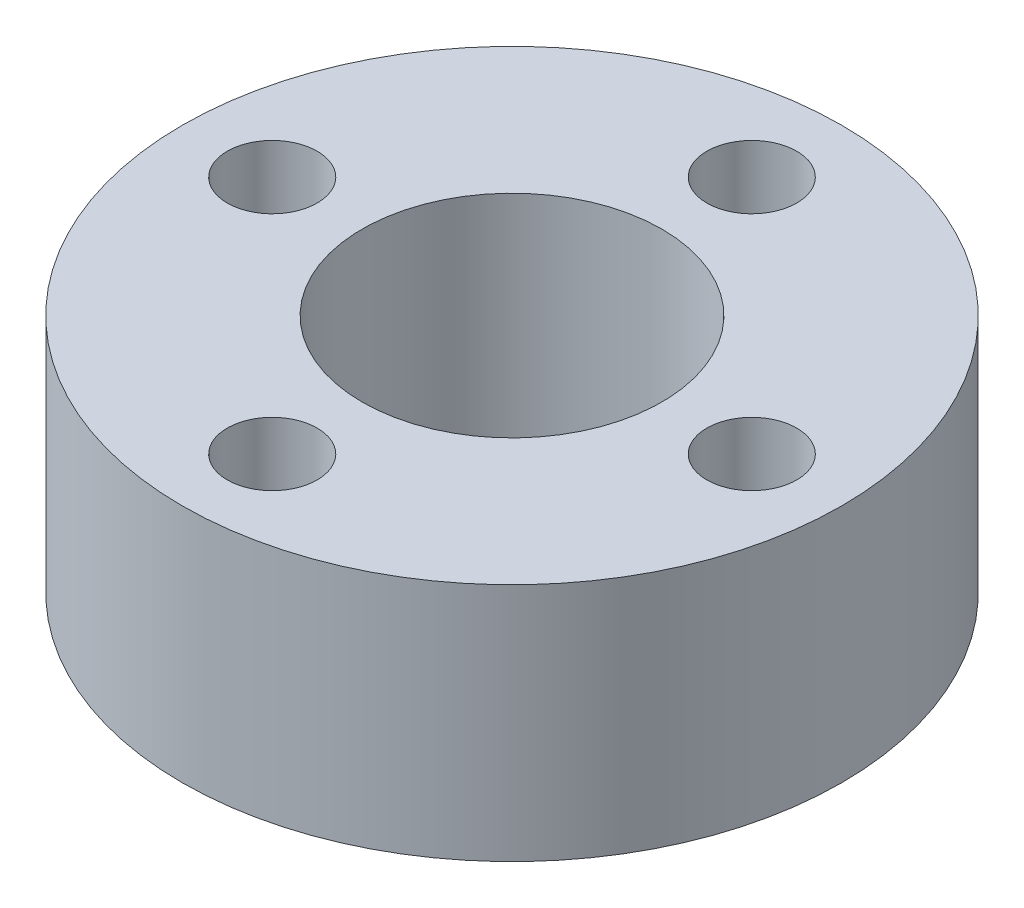
from build123d import *

# Parameters (mm, degrees)
SKETCH_1_R      = 11
SKETCH_1_R_2    = 5
SKETCH_1_R_3    = 1.5
EXTRUDE_1_DEPTH = 8


with BuildPart() as part:
    # 草图1 → 凸台-拉伸1 (new body)
    with BuildSketch(Plane(origin=(0, 0, 0), x_dir=(1, 0, 0), z_dir=(0, 1, 0))):
        with Locations(Location((0, 0, 0), (0, 0, 270))):
            Circle(SKETCH_1_R)
        with Locations(Location((0, 0, 0), (0, 0, 270))):
            Circle(SKETCH_1_R_2, mode=Mode.SUBTRACT)
        with Locations(Location((0, 8, 0), (0, 0, 270))):
            Circle(SKETCH_1_R_3, mode=Mode.SUBTRACT)
        with Locations(Location((8, 0, 0), (0, 0, 270))):
            Circle(SKETCH_1_R_3, mode=Mode.SUBTRACT)
        with Locations(Location((0, -8, 0), (0, 0, 270))):
            Circle(SKETCH_1_R_3, mode=Mode.SUBTRACT)
        with Locations(Location((-8, 0, 0), (0, 0, 270))):
            Circle(SKETCH_1_R_3, mode=Mode.SUBTRACT)
    extrude(amount=EXTRUDE_1_DEPTH)


solid = part.part
